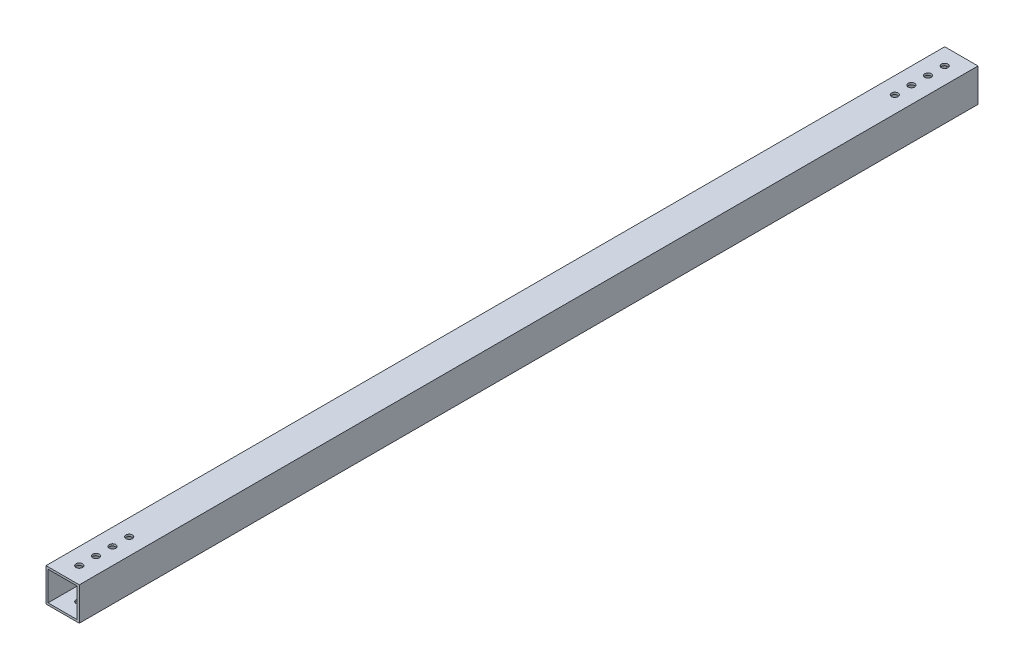
from build123d import *

# Parameters (mm, degrees)
SKETCH1_W           = 25.4
SKETCH1_H           = 25.4
BOSS_EXTRUDE1_DEPTH = 342.9
SHELL1_T            = -1.5875
SKETCH2_R           = 2.4892
CUT_EXTRUDE1_DEPTH  = 344.370048199


with BuildPart() as part:
    # Sketch1 → Boss-Extrude1 (new, symmetric)
    with BuildSketch(Plane.XY):
        Rectangle(SKETCH1_W, SKETCH1_H)
    extrude(amount=BOSS_EXTRUDE1_DEPTH, both=True)

    # Shell1
    shell1_openings = [part.faces().sort_by_distance(p)[0] for p in [
        (0, 0, 342.9),
        (0, 0, -342.9),
    ]]
    offset(amount=SHELL1_T, openings=shell1_openings, kind=Kind.INTERSECTION)

    # Sketch2 → Cut-Extrude1 (cut, symmetric)
    with BuildSketch(Plane(origin=(0, 0, 0), x_dir=(1, 0, 0), z_dir=(0, 1, 0))):
        with Locations(Location((0, -330.2, 0), (0, 0, 270))):
            Circle(SKETCH2_R)
        with Locations(Location((0, -317.5, 0), (0, 0, 270))):
            Circle(SKETCH2_R)
        with Locations(Location((0, -304.8, 0), (0, 0, 270))):
            Circle(SKETCH2_R)
        with Locations(Location((0, -292.1, 0), (0, 0, 270))):
            Circle(SKETCH2_R)
    cut_extrude1 = extrude(amount=CUT_EXTRUDE1_DEPTH, both=True, mode=Mode.SUBTRACT)

    # Mirror1: Cut-Extrude1 across plane
    add(cut_extrude1.mirror(Plane.XY), mode=Mode.SUBTRACT)


solid = part.part
